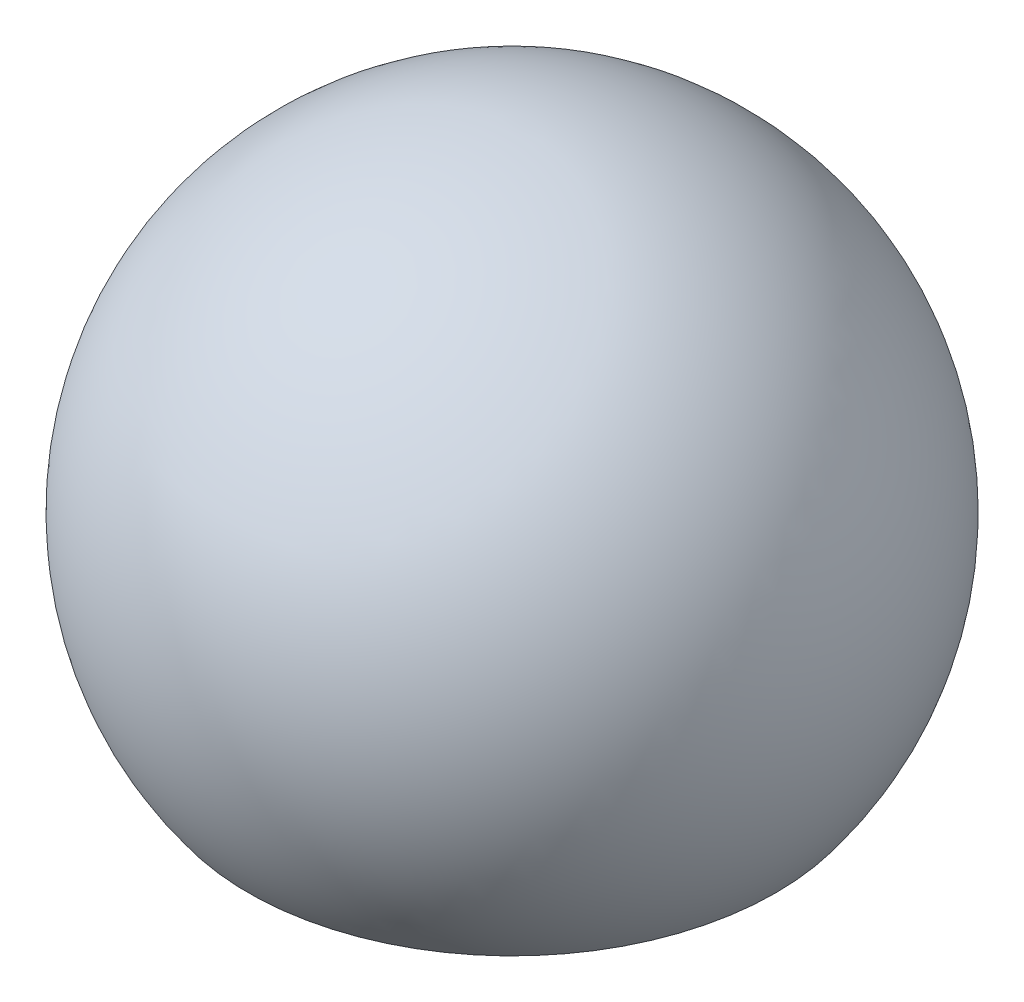
from build123d import *


with BuildPart() as part:
    # Sketch1 → Revolve1 (revolve)
    with BuildSketch(Plane.XY):
        with BuildLine():
            Line((0, 0.25), (0, -0.15))
            Line((0, -0.15), (0.2, -0.15))
            ThreePointArc((0.2, -0.15), (0.223606798, 0.111803399), (0, 0.25))
        make_face()
    revolve(axis=Axis((0, 0.25, 0), (0, -1, 0)))


solid = part.part
